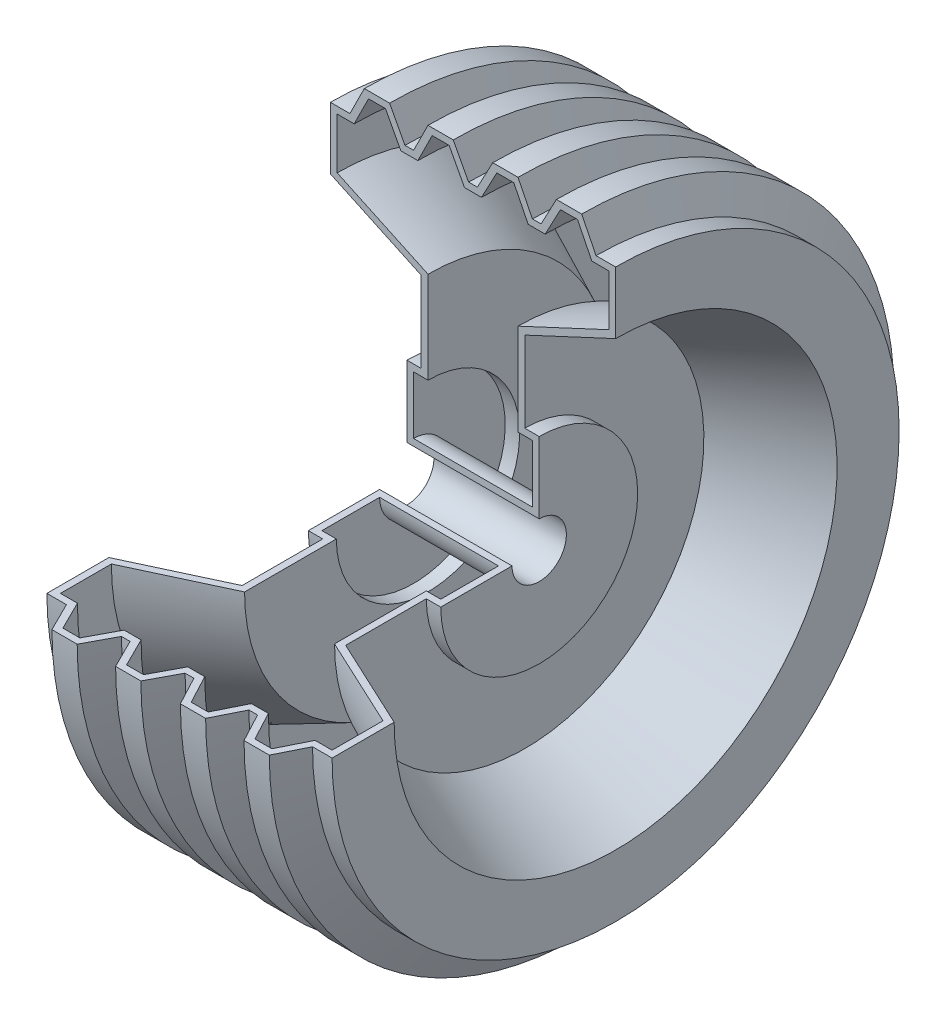
from build123d import *

# Parameters (mm, degrees)
REVOLVE_THIN1_ANGLE = 270


with BuildPart() as part:
    # Sketch1<2> → Revolve-Thin1 (revolve)
    with BuildSketch(Plane.XY):
        Polygon((-39, 16), (39, 16), (39, 58), (30.5, 58), (30.5, 105.504259245), (84, 130.451718957), (84, 167), (72.477223993, 167), (64.016284331, 184), (49.135617862, 184), (40.096557524, 167), (34.977223993, 167), (26.516284331, 184), (11.635617862, 184), (2.596557524, 167), (-2.596557524, 167), (-11.635617862, 184), (-26.516284331, 184), (-34.977223993, 167), (-40.096557524, 167), (-49.135617862, 184), (-64.016284331, 184), (-72.477223993, 167), (-84, 167), (-84, 130.451718957), (-30.5, 105.504259245), (-30.5, 58), (-39, 58), align=None)
        Polygon((-35, 20), (35, 20), (35, 54), (26.5, 54), (26.5, 108.052540289), (80, 133), (80, 163), (70, 163), (61.539060338, 180), (51.539060338, 180), (42.5, 163), (32.5, 163), (24.039060338, 180), (14.039060338, 180), (5, 163), (-5, 163), (-14.039060338, 180), (-24.039060338, 180), (-32.5, 163), (-42.5, 163), (-51.539060338, 180), (-61.539060338, 180), (-70, 163), (-80, 163), (-80, 133), (-26.5, 108.052540289), (-26.5, 54), (-35, 54), align=None, mode=Mode.SUBTRACT)
    revolve(axis=Axis((0, 0, 0), (-1, 0, 0)), revolution_arc=REVOLVE_THIN1_ANGLE)


solid = part.part
